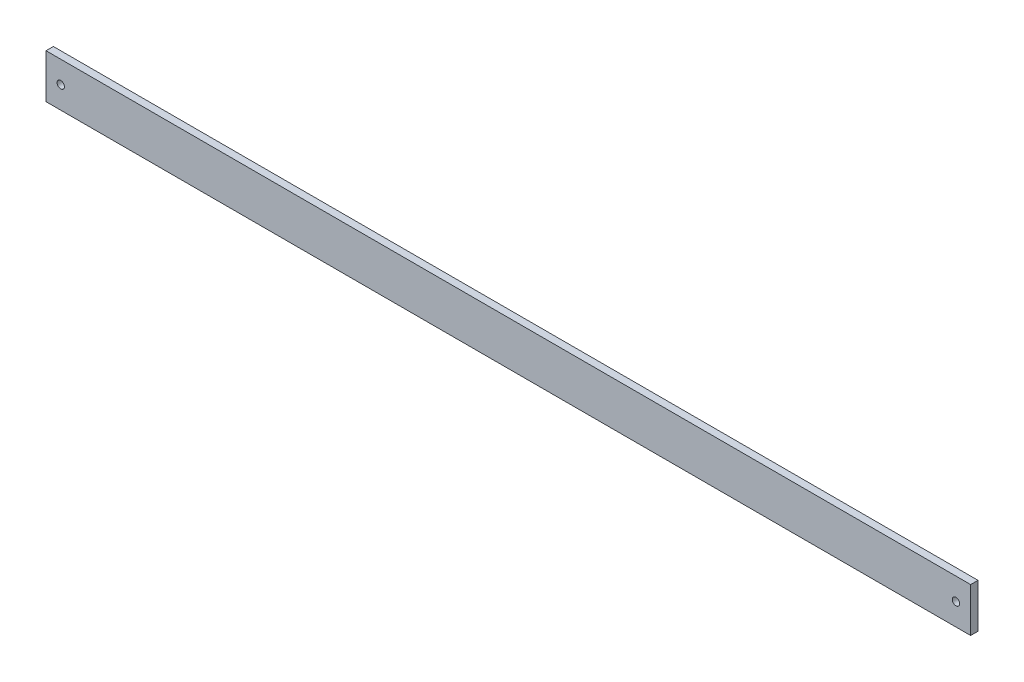
from build123d import *

# Parameters (mm, degrees)
SKETCH7_W           = 398.9578
SKETCH7_H           = 19.05
SKETCH7_R           = 1.5875
BOSS_EXTRUDE1_DEPTH = 3.175


with BuildPart() as part:
    # Sketch7 → Boss-Extrude1 (new body)
    with BuildSketch(Plane.XY):
        with Locations((199.4789, 9.525)):
            Rectangle(SKETCH7_W, SKETCH7_H)
        with Locations((6.35, 9.525)):
            Circle(SKETCH7_R, mode=Mode.SUBTRACT)
        with Locations((392.6078, 9.525)):
            Circle(SKETCH7_R, mode=Mode.SUBTRACT)
    extrude(amount=BOSS_EXTRUDE1_DEPTH)


solid = part.part
